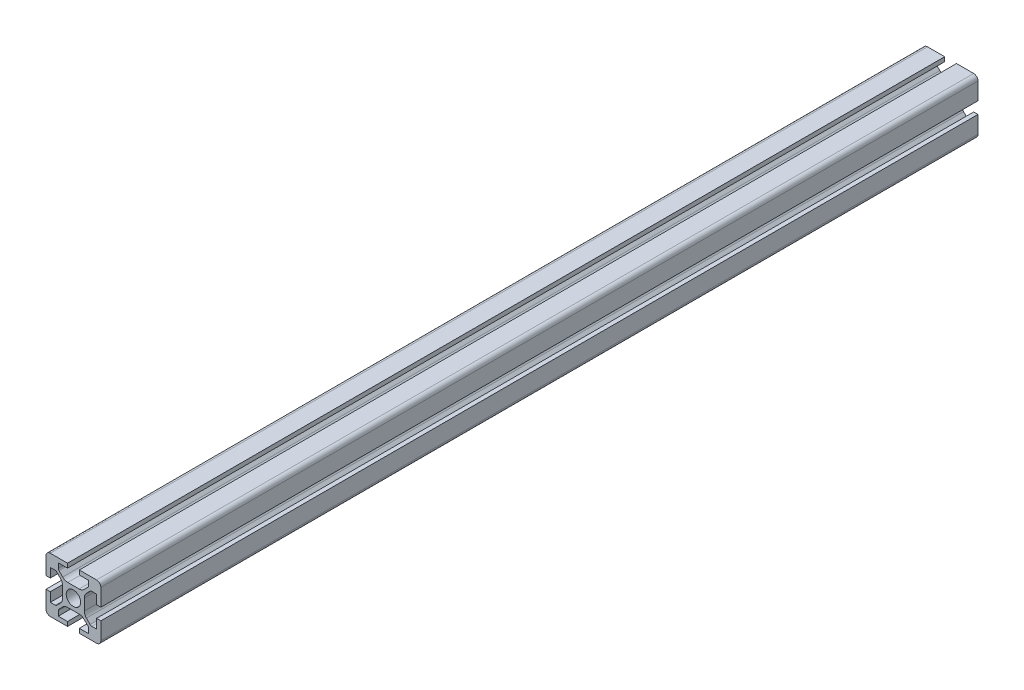
from build123d import *

# Parameters (mm, degrees)
SKETCH1_R           = 5
BOSS_EXTRUDE1_DEPTH = 304.8
CUT_EXTRUDE1_DEPTH  = 6000
CUT_EXTRUDE2_DEPTH  = 6000
CUT_EXTRUDE3_START  = -6000
CUT_EXTRUDE3_DEPTH  = 6000
CUT_EXTRUDE4_DEPTH  = 6000
CUT_EXTRUDE5_DEPTH  = 6000


with BuildPart() as part:
    # Sketch1 → Boss-Extrude1 (new, symmetric)
    with BuildSketch(Plane.XY):
        with BuildLine():
            Line((-19.05, -4.1), (-19.05, -16.05))
            ThreePointArc((-19.05, -16.05), (-18.171320344, -18.171320344), (-16.05, -19.05))
            Line((-16.05, -19.05), (-4.1, -19.05))
            Line((-4.1, -19.05), (-4.1, -16.05))
            Line((-4.1, -16.05), (-10.5, -16.05))
            Line((-10.5, -16.05), (-10.5, -12.7127))
            ThreePointArc((-10.5, -12.7127), (-10.378208373, -12.100409218), (-10.03135, -11.58135))
            Line((-10.03135, -11.58135), (-7.464465, -9.014465))
            ThreePointArc((-7.464465, -9.014465), (-5.842347304, -7.930602396), (-3.92893, -7.55))
            Line((-3.92893, -7.55), (3.92893, -7.55))
            ThreePointArc((3.92893, -7.55), (5.842347304, -7.930602396), (7.464465, -9.014465))
            Line((7.464465, -9.014465), (10.03135, -11.58135))
            ThreePointArc((10.03135, -11.58135), (10.378208373, -12.100409218), (10.5, -12.7127))
            Line((10.5, -12.7127), (10.5, -16.05))
            Line((10.5, -16.05), (4.1, -16.05))
            Line((4.1, -16.05), (4.1, -19.05))
            Line((4.1, -19.05), (16.05, -19.05))
            ThreePointArc((16.05, -19.05), (18.171320344, -18.171320344), (19.05, -16.05))
            Line((19.05, -16.05), (19.05, -4.1))
            Line((19.05, -4.1), (16.05, -4.1))
            Line((16.05, -4.1), (16.05, -10.5))
            Line((16.05, -10.5), (12.7127, -10.5))
            ThreePointArc((12.7127, -10.5), (12.100409218, -10.378208373), (11.58135, -10.03135))
            Line((11.58135, -10.03135), (9.014465, -7.464465))
            ThreePointArc((9.014465, -7.464465), (7.930602396, -5.842347304), (7.55, -3.92893))
            Line((7.55, -3.92893), (7.55, 3.92893))
            ThreePointArc((7.55, 3.92893), (7.930602396, 5.842347304), (9.014465, 7.464465))
            Line((9.014465, 7.464465), (11.58135, 10.03135))
            ThreePointArc((11.58135, 10.03135), (12.100409218, 10.378208373), (12.7127, 10.5))
            Line((12.7127, 10.5), (16.05, 10.5))
            Line((16.05, 10.5), (16.05, 4.1))
            Line((16.05, 4.1), (19.05, 4.1))
            Line((19.05, 4.1), (19.05, 16.05))
            ThreePointArc((19.05, 16.05), (18.171320344, 18.171320344), (16.05, 19.05))
            Line((16.05, 19.05), (4.1, 19.05))
            Line((4.1, 19.05), (4.1, 16.05))
            Line((4.1, 16.05), (10.5, 16.05))
            Line((10.5, 16.05), (10.5, 12.7127))
            ThreePointArc((10.5, 12.7127), (10.378208373, 12.100409218), (10.03135, 11.58135))
            Line((10.03135, 11.58135), (7.464465, 9.014465))
            ThreePointArc((7.464465, 9.014465), (5.842347304, 7.930602396), (3.92893, 7.55))
            Line((3.92893, 7.55), (-3.92893, 7.55))
            ThreePointArc((-3.92893, 7.55), (-5.842347304, 7.930602396), (-7.464465, 9.014465))
            Line((-7.464465, 9.014465), (-10.03135, 11.58135))
            ThreePointArc((-10.03135, 11.58135), (-10.378208373, 12.100409218), (-10.5, 12.7127))
            Line((-10.5, 12.7127), (-10.5, 16.05))
            Line((-10.5, 16.05), (-4.1, 16.05))
            Line((-4.1, 16.05), (-4.1, 19.05))
            Line((-4.1, 19.05), (-16.05, 19.05))
            ThreePointArc((-16.05, 19.05), (-18.171320344, 18.171320344), (-19.05, 16.05))
            Line((-19.05, 16.05), (-19.05, 4.1))
            Line((-19.05, 4.1), (-16.05, 4.1))
            Line((-16.05, 4.1), (-16.05, 10.5))
            Line((-16.05, 10.5), (-12.7127, 10.5))
            ThreePointArc((-12.7127, 10.5), (-12.100409218, 10.378208373), (-11.58135, 10.03135))
            Line((-11.58135, 10.03135), (-9.014465, 7.464465))
            ThreePointArc((-9.014465, 7.464465), (-7.930602396, 5.842347304), (-7.55, 3.92893))
            Line((-7.55, 3.92893), (-7.55, -3.92893))
            ThreePointArc((-7.55, -3.92893), (-7.930602396, -5.842347304), (-9.014465, -7.464465))
            Line((-9.014465, -7.464465), (-11.58135, -10.03135))
            ThreePointArc((-11.58135, -10.03135), (-12.100409218, -10.378208373), (-12.7127, -10.5))
            Line((-12.7127, -10.5), (-16.05, -10.5))
            Line((-16.05, -10.5), (-16.05, -4.1))
            Line((-16.05, -4.1), (-19.05, -4.1))
        make_face()
        Circle(SKETCH1_R, mode=Mode.SUBTRACT)
    extrude(amount=BOSS_EXTRUDE1_DEPTH, both=True)

    # Sketch2 → Cut-Extrude1 (cut)
    with BuildSketch(Plane.XY):
        with BuildLine():
            Line((-17.55, -12.5), (-17.55, -16.05))
            ThreePointArc((-17.55, -16.05), (-17.110660172, -17.110660172), (-16.05, -17.55))
            Line((-16.05, -17.55), (-12.5, -17.55))
            ThreePointArc((-12.5, -17.55), (-12.146446609, -17.403553391), (-12, -17.05))
            Line((-12, -17.05), (-12, -12.5))
            ThreePointArc((-12, -12.5), (-12.146446609, -12.146446609), (-12.5, -12))
            Line((-12.5, -12), (-17.05, -12))
            ThreePointArc((-17.05, -12), (-17.403553391, -12.146446609), (-17.55, -12.5))
        make_face()
    extrude(amount=-CUT_EXTRUDE1_DEPTH, mode=Mode.SUBTRACT)

    # Sketch3 → Cut-Extrude2 (cut)
    with BuildSketch(Plane.XY):
        with BuildLine():
            Line((12.5, -17.55), (16.05, -17.55))
            ThreePointArc((16.05, -17.55), (17.110660172, -17.110660172), (17.55, -16.05))
            Line((17.55, -16.05), (17.55, -12.5))
            ThreePointArc((17.55, -12.5), (17.403553391, -12.146446609), (17.05, -12))
            Line((17.05, -12), (12.5, -12))
            ThreePointArc((12.5, -12), (12.146446609, -12.146446609), (12, -12.5))
            Line((12, -12.5), (12, -17.05))
            ThreePointArc((12, -17.05), (12.146446609, -17.403553391), (12.5, -17.55))
        make_face()
    extrude(amount=-CUT_EXTRUDE2_DEPTH, mode=Mode.SUBTRACT)

    # Sketch4 → Cut-Extrude3 (cut)
    with BuildSketch(Plane.XY.offset(CUT_EXTRUDE3_START)):
        with BuildLine():
            Line((-6.05, 1.06724), (-6.05, -1.19102))
            Line((-6.05, -1.19102), (-4.85654377, -1.189110006))
            ThreePointArc((-4.85654377, -1.189110006), (-4.594960171, -1.971380488), (-4.208325083, -2.7))
            Line((-4.208325083, -2.7), (-6.05, -2.7))
            Line((-6.05, -2.7), (-6.05, -5.05))
            ThreePointArc((-6.05, -5.05), (-5.757106781, -5.757106781), (-5.05, -6.05))
            Line((-5.05, -6.05), (-2.7, -6.05))
            Line((-2.7, -6.05), (-2.7, -4.208325083))
            ThreePointArc((-2.7, -4.208325083), (-1.952880863, -4.602853064), (-1.15, -4.865953144))
            Line((-1.15, -4.865953144), (-1.15, -6.05))
            Line((-1.15, -6.05), (1.15, -6.05))
            Line((1.15, -6.05), (1.15, -4.865953144))
            ThreePointArc((1.15, -4.865953144), (1.952880863, -4.602853064), (2.7, -4.208325083))
            Line((2.7, -4.208325083), (2.7, -6.05))
            Line((2.7, -6.05), (5.05, -6.05))
            ThreePointArc((5.05, -6.05), (5.757106781, -5.757106781), (6.05, -5.05))
            Line((6.05, -5.05), (6.05, -2.7))
            Line((6.05, -2.7), (4.208325083, -2.7))
            ThreePointArc((4.208325083, -2.7), (4.598107084, -1.964029338), (4.860322362, -1.173569996))
            Line((4.860322362, -1.173569996), (6.05, -1.17167))
            Line((6.05, -1.17167), (6.05, 1.10628))
            Line((6.05, 1.10628), (4.876934876, 1.102499983))
            ThreePointArc((4.876934876, 1.102499983), (4.612319233, 1.930417389), (4.208325083, 2.7))
            Line((4.208325083, 2.7), (6.05, 2.7))
            Line((6.05, 2.7), (6.05, 5.05))
            ThreePointArc((6.05, 5.05), (5.757106781, 5.757106781), (5.05, 6.05))
            Line((5.05, 6.05), (2.7, 6.05))
            Line((2.7, 6.05), (2.7, 4.208325083))
            ThreePointArc((2.7, 4.208325083), (1.952880863, 4.602853064), (1.15, 4.865953144))
            Line((1.15, 4.865953144), (1.15, 6.05))
            Line((1.15, 6.05), (-1.15, 6.05))
            Line((-1.15, 6.05), (-1.15, 4.865953144))
            ThreePointArc((-1.15, 4.865953144), (-1.952880863, 4.602853064), (-2.7, 4.208325083))
            Line((-2.7, 4.208325083), (-2.7, 6.05))
            Line((-2.7, 6.05), (-5.05, 6.05))
            ThreePointArc((-5.05, 6.05), (-5.757106781, 5.757106781), (-6.05, 5.05))
            Line((-6.05, 5.05), (-6.05, 2.7))
            Line((-6.05, 2.7), (-4.208325083, 2.7))
            ThreePointArc((-4.208325083, 2.7), (-4.618524958, 1.9155227), (-4.883949119, 1.071000003))
            Line((-4.883949119, 1.071000003), (-6.05, 1.06724))
        make_face()
    extrude(amount=CUT_EXTRUDE3_DEPTH, mode=Mode.SUBTRACT)

    # Sketch5 → Cut-Extrude4 (cut)
    with BuildSketch(Plane.XY):
        with BuildLine():
            Line((12, 17.05), (12, 12.5))
            ThreePointArc((12, 12.5), (12.146446609, 12.146446609), (12.5, 12))
            Line((12.5, 12), (17.05, 12))
            ThreePointArc((17.05, 12), (17.403553391, 12.146446609), (17.55, 12.5))
            Line((17.55, 12.5), (17.55, 16.05))
            ThreePointArc((17.55, 16.05), (17.110660172, 17.110660172), (16.05, 17.55))
            Line((16.05, 17.55), (12.5, 17.55))
            ThreePointArc((12.5, 17.55), (12.146446609, 17.403553391), (12, 17.05))
        make_face()
    extrude(amount=-CUT_EXTRUDE4_DEPTH, mode=Mode.SUBTRACT)

    # Sketch6 → Cut-Extrude5 (cut)
    with BuildSketch(Plane.XY):
        with BuildLine():
            Line((-17.05, 12), (-12.5, 12))
            ThreePointArc((-12.5, 12), (-12.146446609, 12.146446609), (-12, 12.5))
            Line((-12, 12.5), (-12, 17.05))
            ThreePointArc((-12, 17.05), (-12.146446609, 17.403553391), (-12.5, 17.55))
            Line((-12.5, 17.55), (-16.05, 17.55))
            ThreePointArc((-16.05, 17.55), (-17.110660172, 17.110660172), (-17.55, 16.05))
            Line((-17.55, 16.05), (-17.55, 12.5))
            ThreePointArc((-17.55, 12.5), (-17.403553391, 12.146446609), (-17.05, 12))
        make_face()
    extrude(amount=-CUT_EXTRUDE5_DEPTH, mode=Mode.SUBTRACT)


solid = part.part
